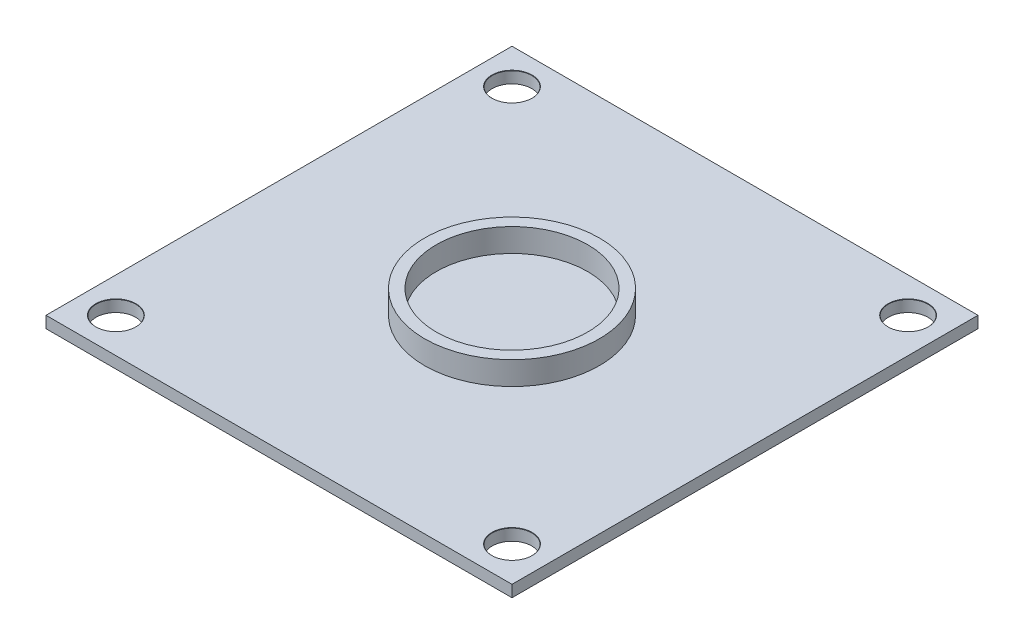
from build123d import *

# Parameters (mm, degrees)
SKETCH1_W                     = 40
SKETCH1_H                     = 40
BOSS_EXTRUDE1_DEPTH           = 1
SKETCH2_R                     = 7.5
SKETCH2_R_2                   = 6.5
BOSS_EXTRUDE2_DEPTH           = 2
M3_CLEARANCE_HOLE1_AT_2_COUNT = 2
M3_CLEARANCE_HOLE1_AT_2_PITCH = 34
M3_CLEARANCE_HOLE1_AT_3_COUNT = 2
M3_CLEARANCE_HOLE1_AT_3_PITCH = 48.083261121
M3_CLEARANCE_HOLE1_AT_4_COUNT = 2
M3_CLEARANCE_HOLE1_AT_4_PITCH = 34


with BuildPart() as part:
    # Sketch1 → Boss-Extrude1 (new body)
    with BuildSketch(Plane(origin=(0, 0, 0), x_dir=(1, 0, 0), z_dir=(0, 1, 0))):
        with Locations((20, 20)):
            Rectangle(SKETCH1_W, SKETCH1_H)
    extrude(amount=BOSS_EXTRUDE1_DEPTH)

    # Sketch2 → Boss-Extrude2 (add)
    with BuildSketch(Plane(origin=(0, 1, 0), x_dir=(1, 0, 0), z_dir=(0, 1, 0))):
        with Locations(Location((20, 20, 0), (0, 0, 90))):
            Circle(SKETCH2_R)
        with Locations(Location((20, 20, 0), (0, 0, 270))):
            Circle(SKETCH2_R_2, mode=Mode.SUBTRACT)
    extrude(amount=BOSS_EXTRUDE2_DEPTH)

    # Sketch4 → M3 Clearance Hole1 (revolve, cut)
    with BuildSketch(Plane(origin=(3, 1, -3), x_dir=(0, 0, 1), z_dir=(1, 0, 0))):
        Polygon((0, 0), (0, 1), (1.7, 1), (1.7, 0.025), (1.725, 0), align=None)
    m3_clearance_hole1 = revolve(axis=Axis((3, 7.35, -3), (0, -1, 0)), mode=Mode.SUBTRACT)

    # M3 Clearance Hole1 at 2: M3 Clearance Hole1 ×2
    with Locations(*[(0, 0, -i * M3_CLEARANCE_HOLE1_AT_2_PITCH) for i in range(1, M3_CLEARANCE_HOLE1_AT_2_COUNT)]):
        add(m3_clearance_hole1, mode=Mode.SUBTRACT)

    # M3 Clearance Hole1 at 3: M3 Clearance Hole1 ×2
    with Locations(*[Vector(0.7071067811865477, 0, -0.7071067811865474) * (i * M3_CLEARANCE_HOLE1_AT_3_PITCH) for i in range(1, M3_CLEARANCE_HOLE1_AT_3_COUNT)]):
        add(m3_clearance_hole1, mode=Mode.SUBTRACT)

    # M3 Clearance Hole1 at 4: M3 Clearance Hole1 ×2
    with Locations(*[(i * M3_CLEARANCE_HOLE1_AT_4_PITCH, 0, 0) for i in range(1, M3_CLEARANCE_HOLE1_AT_4_COUNT)]):
        add(m3_clearance_hole1, mode=Mode.SUBTRACT)


solid = part.part
